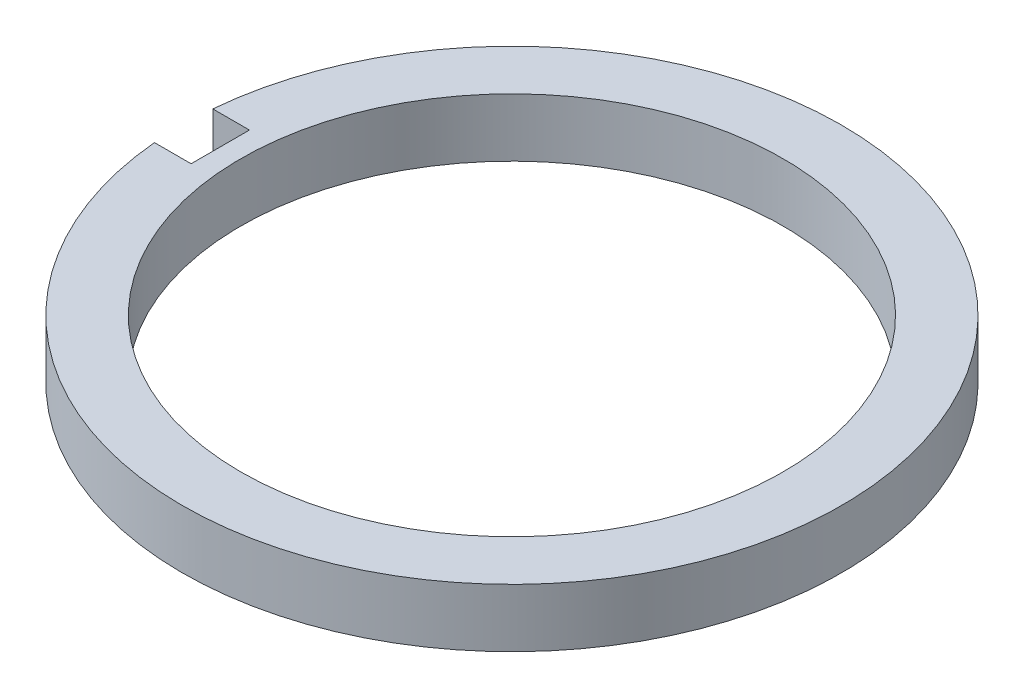
from build123d import *

# Parameters (mm, degrees)
SKETCH1_R           = 71.755
SKETCH1_R_2         = 59.055
BOSS_EXTRUDE1_DEPTH = 12.7
SKETCH2_W           = 25.4
SKETCH2_H           = 12.7
CUT_EXTRUDE1_DEPTH  = 103.26851935


with BuildPart() as part:
    # Sketch1 → Boss-Extrude1 (new body)
    with BuildSketch(Plane(origin=(0, 0, 0), x_dir=(1, 0, 0), z_dir=(0, 1, 0))):
        with Locations(Location((0, 0, 0), (0, 0, 270))):
            Circle(SKETCH1_R)
        with Locations(Location((0, 0, 0), (0, 0, 270))):
            Circle(SKETCH1_R_2, mode=Mode.SUBTRACT)
    extrude(amount=BOSS_EXTRUDE1_DEPTH)

    # Sketch2 → Cut-Extrude1 (cut, through all)
    with BuildSketch(Plane(origin=(0, 12.7, 0), x_dir=(1, 0, 0), z_dir=(0, 1, 0))):
        with Locations((-76.2, 0)):
            Rectangle(SKETCH2_W, SKETCH2_H)
    extrude(amount=-CUT_EXTRUDE1_DEPTH, mode=Mode.SUBTRACT)


solid = part.part
